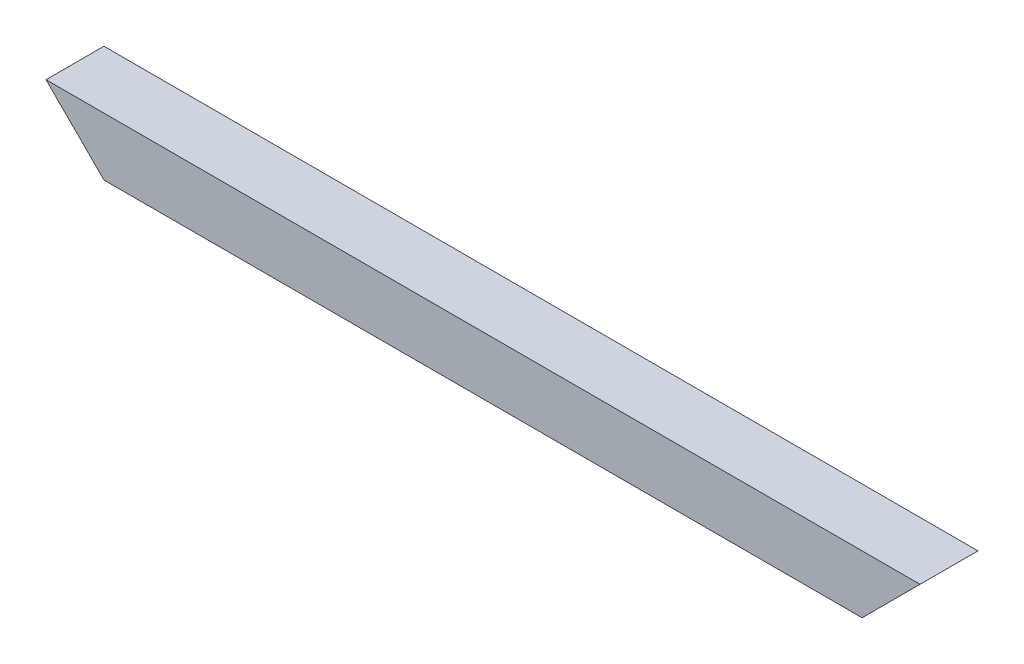
from build123d import *

# Parameters (mm, degrees)
SKETCH1_W               = 38.1
SKETCH1_H               = 38.1
BOSS_EXTRUDE1_DEPTH     = 574.7363918
CUT_EXTRUDE1_DEPTH      = 578.256563461
CUT_EXTRUDE1_DEPTH_BACK = 578.256563461
CUT_EXTRUDE2_DEPTH      = 578.256563461
CUT_EXTRUDE2_DEPTH_BACK = 578.256563461


with BuildPart() as part:
    # Sketch1 → Boss-Extrude1 (new body)
    with BuildSketch(Plane(origin=(0, 0, 0), x_dir=(0, 0, -1), z_dir=(1, 0, 0))):
        with Locations((19.05, -19.05)):
            Rectangle(SKETCH1_W, SKETCH1_H)
    extrude(amount=BOSS_EXTRUDE1_DEPTH)

    # Sketch2 → Cut-Extrude1 (cut, two sides: drawn at the far end of the back side and taken through both)
    with BuildSketch(Plane.XY.offset(-CUT_EXTRUDE1_DEPTH_BACK)):
        Polygon((-1161.9957119, -38.1), (0, -38.1), (38.1, -38.1), (0, 0), (-821.655047595, 821.655047595), (-2982.499615844, 1677.042030058), (-3322.84028015, 817.286982464), align=None)
    extrude(amount=CUT_EXTRUDE1_DEPTH + CUT_EXTRUDE1_DEPTH_BACK, mode=Mode.SUBTRACT)

    # Sketch3 → Cut-Extrude2 (cut, two sides: drawn at the far end of the back side and taken through both)
    with BuildSketch(Plane.XY.offset(-CUT_EXTRUDE2_DEPTH_BACK)):
        Polygon((1736.7321037, -38.1), (574.7363918, -38.1), (536.6363918, -38.1), (574.7363918, 0), (1396.391439395, 821.655047595), (3557.236007644, 1677.042030058), (3897.57667195, 817.286982464), align=None)
    extrude(amount=CUT_EXTRUDE2_DEPTH + CUT_EXTRUDE2_DEPTH_BACK, mode=Mode.SUBTRACT)


solid = part.part
